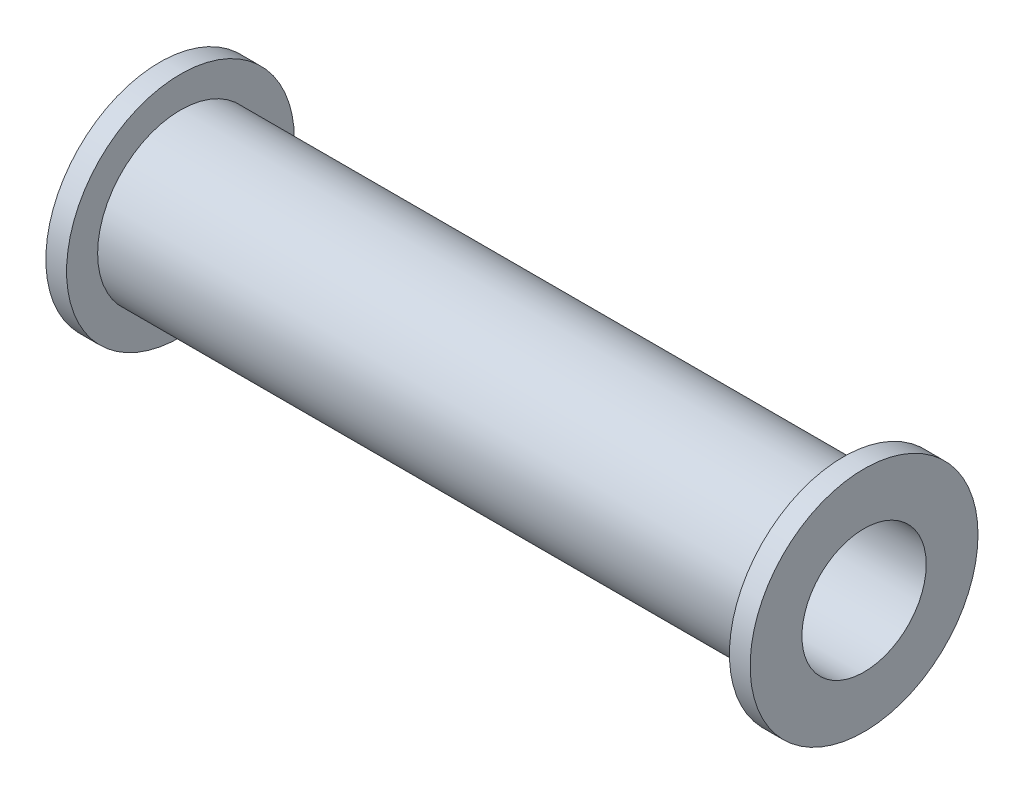
from build123d import *

# Parameters (mm, degrees)
SKETCH1_R           = 8.73125
BOSS_EXTRUDE1_DEPTH = 1.5875
SKETCH2_R           = 6.35
BOSS_EXTRUDE2_DEPTH = 50.8
SKETCH3_R           = 8.73125
BOSS_EXTRUDE3_DEPTH = 1.5875
SKETCH4_R           = 4.7625
CUT_EXTRUDE1_DEPTH  = 56.369396584


with BuildPart() as part:
    # Sketch1 → Boss-Extrude1 (new body)
    with BuildSketch(Plane(origin=(0, 0, 0), x_dir=(0, 0, -1), z_dir=(1, 0, 0))):
        Circle(SKETCH1_R)
    extrude(amount=BOSS_EXTRUDE1_DEPTH)

    # Sketch2 → Boss-Extrude2 (add)
    with BuildSketch(Plane(origin=(1.5875, 0, 0), x_dir=(0, 0, -1), z_dir=(1, 0, 0))):
        Circle(SKETCH2_R)
    extrude(amount=BOSS_EXTRUDE2_DEPTH)

    # Sketch3 → Boss-Extrude3 (add)
    with BuildSketch(Plane(origin=(52.3875, 0, 0), x_dir=(0, 0, -1), z_dir=(1, 0, 0))):
        Circle(SKETCH3_R)
    extrude(amount=BOSS_EXTRUDE3_DEPTH)

    # Sketch4 → Cut-Extrude1 (cut, through all)
    with BuildSketch(Plane(origin=(53.975, 0, 0), x_dir=(0, 0, -1), z_dir=(1, 0, 0))):
        Circle(SKETCH4_R)
    extrude(amount=-CUT_EXTRUDE1_DEPTH, mode=Mode.SUBTRACT)


solid = part.part
